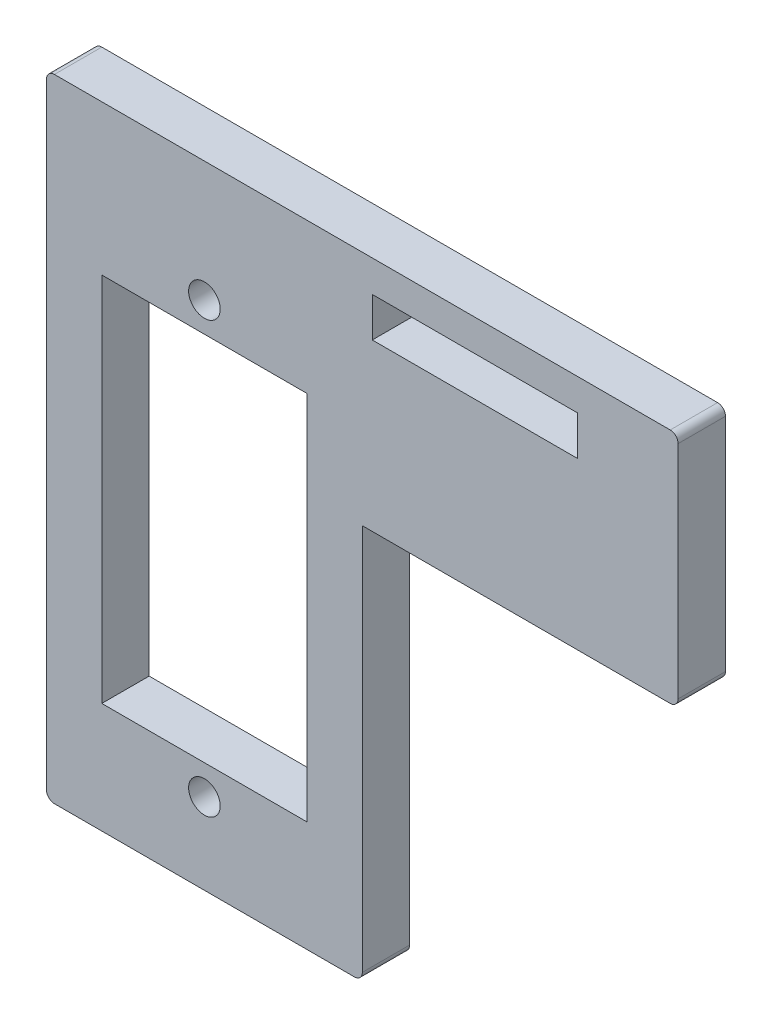
from build123d import *

# Parameters (mm, degrees)
IZIM1_W                     = 13
IZIM1_H                     = 23.5
Y_KSEKLIK_EKSTR_ZYON1_DEPTH = 3
RADYUS1_R                   = 0.5
KES_EKSTR_ZYON1_REACH       = 38.886
IZIM5_R                     = 1
KES_EKSTR_ZYON2_REACH       = 38.886
IZIM6_W                     = 13
IZIM6_H                     = 2.5


with BuildPart() as part:
    # Çizim1 → Yükseklik-Ekstrüzyon1 (new body)
    with BuildSketch(Plane.XY):
        Polygon((10, 21.25), (30, 21.25), (30, 6.25), (10, 6.25), (10, -18.75), (-10, -18.75), (-10, 21.25), align=None)
        Rectangle(IZIM1_W, IZIM1_H, mode=Mode.SUBTRACT)
    extrude(amount=Y_KSEKLIK_EKSTR_ZYON1_DEPTH)

    # Radyus1
    radyus1_edges = [part.edges().sort_by_distance(p)[0] for p in [
        (-10, 21.25, 1.5),
        (30, 21.25, 1.5),
        (30, 6.25, 1.5),
        (10, -18.75, 1.5),
        (-10, -18.75, 1.5),
    ]]
    fillet(radyus1_edges, radius=RADYUS1_R)

    # Çizim5 → Kes-Ekstrüzyon1 (cut, up to next)
    with BuildSketch(Plane(origin=(0, 0, 0), x_dir=(-1, 0, 0), z_dir=(0, 0, -1)), mode=Mode.PRIVATE) as kes_ekstr_zyon1_sk1:
        with Locations((0, 13.625)):
            Circle(IZIM5_R)
    kes_ekstr_zyon1_tool1 = extrude(kes_ekstr_zyon1_sk1.sketch, amount=-KES_EKSTR_ZYON1_REACH, mode=Mode.PRIVATE) & part.part
    # Çizim5 → Kes-Ekstrüzyon1 (cut, up to next)
    with BuildSketch(Plane(origin=(0, 0, 0), x_dir=(-1, 0, 0), z_dir=(0, 0, -1)), mode=Mode.PRIVATE) as kes_ekstr_zyon1_sk2:
        with Locations((0, -13.625)):
            Circle(IZIM5_R)
    kes_ekstr_zyon1_tool2 = extrude(kes_ekstr_zyon1_sk2.sketch, amount=-KES_EKSTR_ZYON1_REACH, mode=Mode.PRIVATE) & part.part
    add(kes_ekstr_zyon1_tool1.solids().sort_by_distance((0, 13.625, 0))[0], mode=Mode.SUBTRACT)
    add(kes_ekstr_zyon1_tool2.solids().sort_by_distance((0, -13.625, 0))[0], mode=Mode.SUBTRACT)

    # Çizim6 → Kes-Ekstrüzyon2 (cut, up to next)
    with BuildSketch(Plane(origin=(0, 0, 0), x_dir=(-1, 0, 0), z_dir=(0, 0, -1)), mode=Mode.PRIVATE) as kes_ekstr_zyon2_sk1:
        with Locations((-17.130228212, 18)):
            Rectangle(IZIM6_W, IZIM6_H)
    kes_ekstr_zyon2_tool1 = extrude(kes_ekstr_zyon2_sk1.sketch, amount=-KES_EKSTR_ZYON2_REACH, mode=Mode.PRIVATE) & part.part
    add(kes_ekstr_zyon2_tool1.solids().sort_by_distance((17.130228, 18, 0))[0], mode=Mode.SUBTRACT)


solid = part.part
